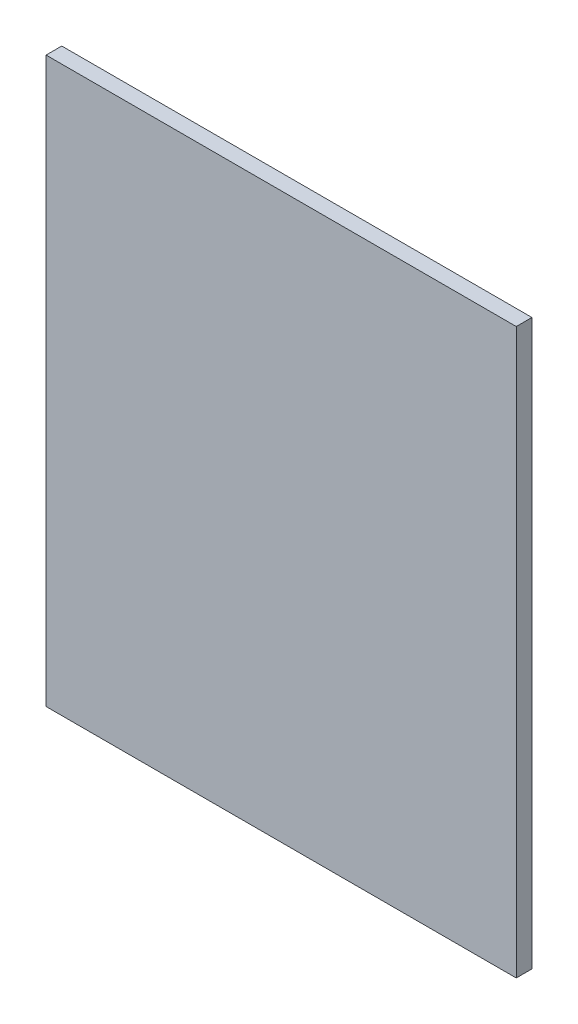
from build123d import *

# Parameters (mm, degrees)
SKETCH1_W           = 190.5
SKETCH1_H           = 228.6
BOSS_EXTRUDE1_DEPTH = 6.35


with BuildPart() as part:
    # Sketch1 → Boss-Extrude1 (new body)
    with BuildSketch(Plane.XY):
        with Locations((95.25, 114.3)):
            Rectangle(SKETCH1_W, SKETCH1_H)
    extrude(amount=BOSS_EXTRUDE1_DEPTH)


solid = part.part
